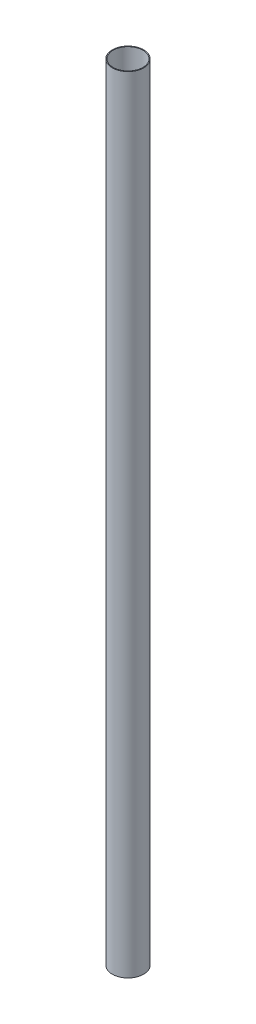
from build123d import *

# Parameters (mm, degrees)
SKETCH_1_R      = 20
SKETCH_1_R_2    = 19
EXTRUDE_1_DEPTH = 1000


with BuildPart() as part:
    # Эскиз1 → Бобышка-Вытянуть1 (new body)
    with BuildSketch(Plane(origin=(0, 0, 0), x_dir=(1, 0, 0), z_dir=(0, 1, 0))):
        with Locations(Location((0, 0, 0), (0, 0, 270))):
            Circle(SKETCH_1_R)
        with Locations(Location((0, 0, 0), (0, 0, 270))):
            Circle(SKETCH_1_R_2, mode=Mode.SUBTRACT)
    extrude(amount=EXTRUDE_1_DEPTH)


solid = part.part
